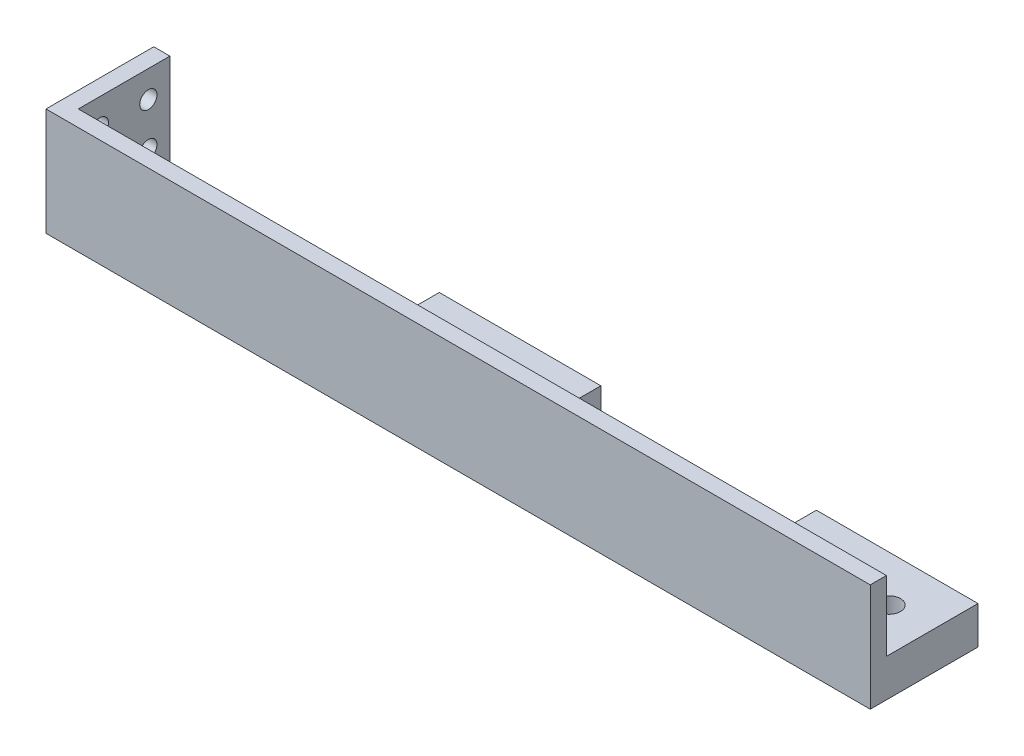
from build123d import *

# Parameters (mm, degrees)
SKETCH1_W           = 153
SKETCH1_H           = 20
BOSS_EXTRUDE1_DEPTH = 3
SKETCH2_W           = 3
SKETCH2_H           = 20
BOSS_EXTRUDE2_DEPTH = 17
SKETCH3_W           = 150
SKETCH3_H           = 3
BOSS_EXTRUDE3_DEPTH = 17
SKETCH4_R           = 1.6
SKETCH4_R_2         = 1.598435099
CUT_EXTRUDE1_DEPTH  = 10
SKETCH6_W           = 30
SKETCH6_H           = 17
BOSS_EXTRUDE4_DEPTH = 4
SKETCH7_R           = 2.1
CUT_EXTRUDE3_DEPTH  = 243.348358538
SKETCH8_R           = 4
CUT_EXTRUDE4_DEPTH  = 2.5
SKETCH9_W           = 30
SKETCH9_H           = 17
BOSS_EXTRUDE5_DEPTH = 4
SKETCH12_R          = 2.1
CUT_EXTRUDE7_DEPTH  = 243.348358538
SKETCH13_R          = 4
CUT_EXTRUDE8_DEPTH  = 2.5
CHAMFER9_SIZE       = 3
SKETCH15_W          = 3.1
SKETCH15_H          = 17
CUT_EXTRUDE10_DEPTH = 3


with BuildPart() as part:
    # Sketch1 → Boss-Extrude1 (new body)
    with BuildSketch(Plane.XY):
        with Locations((164.901588409, -32.175360178)):
            Rectangle(SKETCH1_W, SKETCH1_H)
    extrude(amount=BOSS_EXTRUDE1_DEPTH)

    # Sketch2 → Boss-Extrude2 (add)
    with BuildSketch(Plane(origin=(0, 0, 0), x_dir=(-1, 0, 0), z_dir=(0, 0, -1))):
        with Locations((-89.901588409, -32.175360178)):
            Rectangle(SKETCH2_W, SKETCH2_H)
    extrude(amount=BOSS_EXTRUDE2_DEPTH)

    # Sketch3 → Boss-Extrude3 (add)
    with BuildSketch(Plane(origin=(0, 0, 0), x_dir=(-1, 0, 0), z_dir=(0, 0, -1))):
        with Locations((-166.401588409, -40.675360178)):
            Rectangle(SKETCH3_W, SKETCH3_H)
    extrude(amount=BOSS_EXTRUDE3_DEPTH)

    # Sketch4 → Cut-Extrude1 (cut)
    with BuildSketch(Plane.ZY.offset(-88.401588409)):
        with Locations((-13, -27.175360178)):
            Circle(SKETCH4_R)
        with Locations((-4, -27.175360178)):
            Circle(SKETCH4_R)
        with Locations((-4, -35.175360178)):
            Circle(SKETCH4_R)
        with Locations((-13, -35.175360178)):
            Circle(SKETCH4_R_2)
    extrude(amount=-CUT_EXTRUDE1_DEPTH, mode=Mode.SUBTRACT)

    # Sketch6 → Boss-Extrude4 (add)
    with BuildSketch(Plane(origin=(0, -39.175360178, 0), x_dir=(1, 0, 0), z_dir=(0, 1, 0))):
        with Locations((226.401588409, 8.5)):
            Rectangle(SKETCH6_W, SKETCH6_H)
    extrude(amount=BOSS_EXTRUDE4_DEPTH)

    # Sketch7 → Cut-Extrude3 (cut, through all)
    with BuildSketch(Plane(origin=(0, -35.175360178, 0), x_dir=(1, 0, 0), z_dir=(0, 1, 0))):
        with Locations(Location((219.401588409, 8.5, 0), (0, 0, 270))):
            Circle(SKETCH7_R)
        with Locations(Location((233.401588409, 8.5, 0), (0, 0, 270))):
            Circle(SKETCH7_R)
    extrude(amount=-CUT_EXTRUDE3_DEPTH, mode=Mode.SUBTRACT)

    # Sketch8 → Cut-Extrude4 (cut)
    with BuildSketch(Plane.XZ.offset(42.175360178)):
        with Locations(Location((219.401588409, -8.5, 0), (0, 0, 270))):
            Circle(SKETCH8_R)
        with Locations(Location((233.401588409, -8.5, 0), (0, 0, 270))):
            Circle(SKETCH8_R)
    extrude(amount=-CUT_EXTRUDE4_DEPTH, mode=Mode.SUBTRACT)

    # Sketch9 → Boss-Extrude5 (add)
    with BuildSketch(Plane(origin=(0, -39.175360178, 0), x_dir=(1, 0, 0), z_dir=(0, 1, 0))):
        with Locations((156.401588409, 8.5)):
            Rectangle(SKETCH9_W, SKETCH9_H)
    extrude(amount=BOSS_EXTRUDE5_DEPTH)

    # Sketch12 → Cut-Extrude7 (cut, through all)
    with BuildSketch(Plane(origin=(0, -35.175360178, 0), x_dir=(1, 0, 0), z_dir=(0, 1, 0))):
        with Locations(Location((163.401588409, 8.5, 0), (0, 0, 270))):
            Circle(SKETCH12_R)
        with Locations(Location((149.401588409, 8.5, 0), (0, 0, 270))):
            Circle(SKETCH12_R)
    extrude(amount=-CUT_EXTRUDE7_DEPTH, mode=Mode.SUBTRACT)

    # Sketch13 → Cut-Extrude8 (cut)
    with BuildSketch(Plane.XZ.offset(42.175360178)):
        with Locations(Location((163.401588409, -8.5, 0), (0, 0, 270))):
            Circle(SKETCH13_R)
        with Locations(Location((149.401588409, -8.5, 0), (0, 0, 270))):
            Circle(SKETCH13_R)
    extrude(amount=-CUT_EXTRUDE8_DEPTH, mode=Mode.SUBTRACT)

    # Chamfer9
    chamfer9_edges = [part.edges().sort_by_distance(p)[0] for p in [
        (116.401588409, -39.175360178, 0),
        (191.401588409, -39.175360178, 0),
    ]]
    chamfer(chamfer9_edges, length=CHAMFER9_SIZE)

    # Sketch15 → Cut-Extrude10 (cut)
    with BuildSketch(Plane(origin=(0, -39.175360178, 0), x_dir=(1, 0, 0), z_dir=(0, 1, 0))):
        with Locations((209.851588409, 8.5)):
            Rectangle(SKETCH15_W, SKETCH15_H)
        with Locations((172.951588409, 8.5)):
            Rectangle(SKETCH15_W, SKETCH15_H)
        with Locations((139.851588409, 8.5)):
            Rectangle(SKETCH15_W, SKETCH15_H)
    extrude(amount=CUT_EXTRUDE10_DEPTH, mode=Mode.SUBTRACT)


solid = part.part
